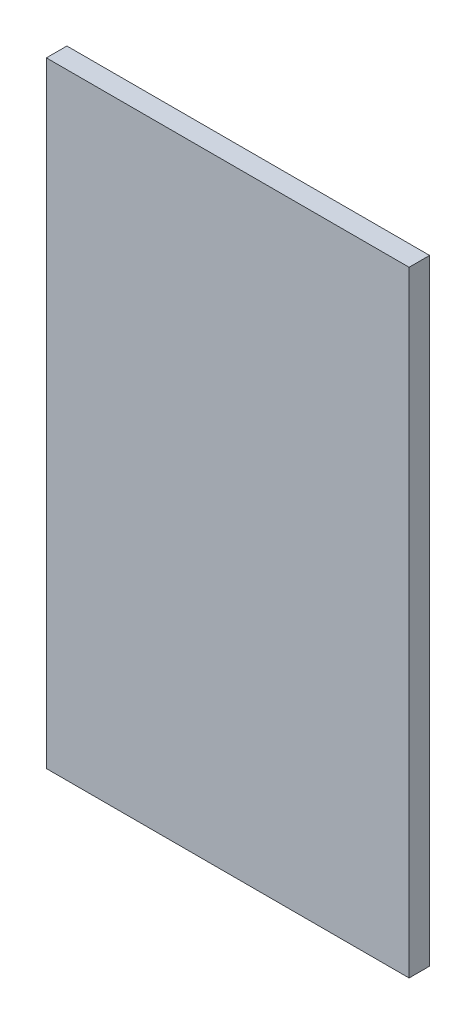
from build123d import *

# Parameters (mm, degrees)
SKETCH_1_W      = 88.39
SKETCH_1_H      = 150
EXTRUDE_1_DEPTH = 5


with BuildPart() as part:
    # 스케치1 → 보스-돌출1 (new body)
    with BuildSketch(Plane.XY):
        Rectangle(SKETCH_1_W, SKETCH_1_H)
    extrude(amount=EXTRUDE_1_DEPTH)


solid = part.part
